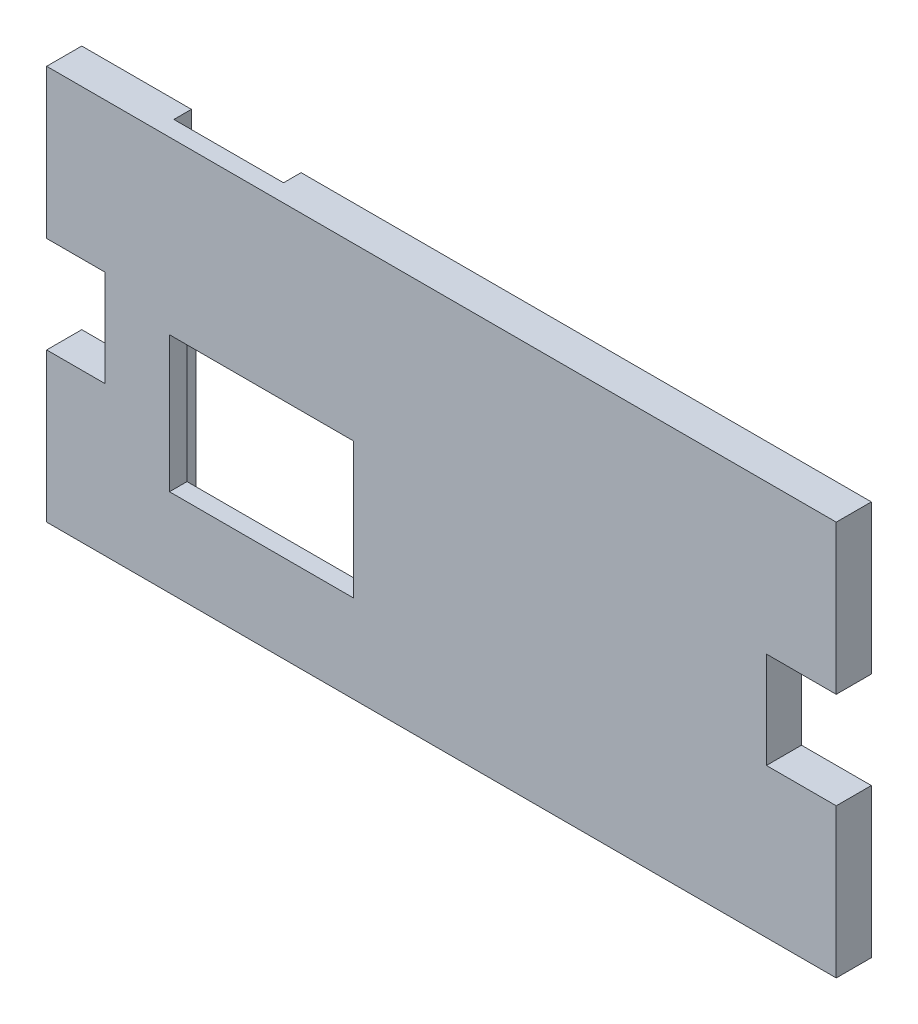
from build123d import *

# Parameters (mm, degrees)
SKETCH1_W                = 180
SKETCH1_H                = 90
BOSS_EXTRUDE1_DEPTH      = 8
SKETCH3_W                = 10
SKETCH3_H                = 10
CUT_EXTRUDE1_DEPTH       = 7
SKETCH4_W                = 25
SKETCH4_H                = 30
SKETCH4_W_2              = 45
SKETCH4_H_2              = 80
SKETCH4_W_3              = 46
SKETCH4_H_3              = 46
CUT_EXTRUDE2_DEPTH       = 4
SKETCH5_W                = 15.917599426
SKETCH5_H                = 22
SKETCH5_W_2              = 13.264666189
CUT_EXTRUDE3_DEPTH       = 101.940576578
CUT_EXTRUDE12_DEPTH      = 101.940576578
CUT_EXTRUDE12_DEPTH_BACK = 101.940576578
SKETCH6_W                = 42
SKETCH6_H                = 31


with BuildPart() as part:
    # Sketch1 → Boss-Extrude1 (new body)
    with BuildSketch(Plane.XY):
        Rectangle(SKETCH1_W, SKETCH1_H)
    extrude(amount=BOSS_EXTRUDE1_DEPTH)

    # Sketch3 → Cut-Extrude1 (cut)
    with BuildSketch(Plane(origin=(0, 0, 0), x_dir=(-1, 0, 0), z_dir=(0, 0, -1))):
        with Locations((-80, -35)):
            Rectangle(SKETCH3_W, SKETCH3_H)
        with Locations((-80, 35)):
            Rectangle(SKETCH3_W, SKETCH3_H)
        with Locations((80, 35)):
            Rectangle(SKETCH3_W, SKETCH3_H)
        with Locations((80, -35)):
            Rectangle(SKETCH3_W, SKETCH3_H)
    extrude(amount=-CUT_EXTRUDE1_DEPTH, mode=Mode.SUBTRACT)

    # Sketch4 → Cut-Extrude2 (cut)
    with BuildSketch(Plane(origin=(0, 0, 0), x_dir=(-1, 0, 0), z_dir=(0, 0, -1))):
        with Locations((52.5, 30)):
            Rectangle(SKETCH4_W, SKETCH4_H)
        with Locations((-27.5, 0)):
            Rectangle(SKETCH4_W_2, SKETCH4_H_2)
        with Locations((41, -12)):
            Rectangle(SKETCH4_W_3, SKETCH4_H_3)
    extrude(amount=-CUT_EXTRUDE2_DEPTH, mode=Mode.SUBTRACT)

    # Sketch5 → Cut-Extrude3 (cut, through all)
    with BuildSketch(Plane(origin=(0, 0, 0), x_dir=(-1, 0, 0), z_dir=(0, 0, -1))):
        with Locations((-82.041200287, 0)):
            Rectangle(SKETCH5_W, SKETCH5_H)
        with Locations((83.367666906, 0)):
            Rectangle(SKETCH5_W_2, SKETCH5_H)
    extrude(amount=-CUT_EXTRUDE3_DEPTH, mode=Mode.SUBTRACT)

    # Sketch6 → Cut-Extrude12 (cut, two sides: drawn at the far end of the back side and taken through both)
    with BuildSketch(Plane(origin=(0, 0, 0), x_dir=(-1, 0, 0), z_dir=(0, 0, -1)).offset(-CUT_EXTRUDE12_DEPTH_BACK)):
        with Locations((41, -9.5)):
            Rectangle(SKETCH6_W, SKETCH6_H)
    extrude(amount=CUT_EXTRUDE12_DEPTH + CUT_EXTRUDE12_DEPTH_BACK, mode=Mode.SUBTRACT)


solid = part.part
